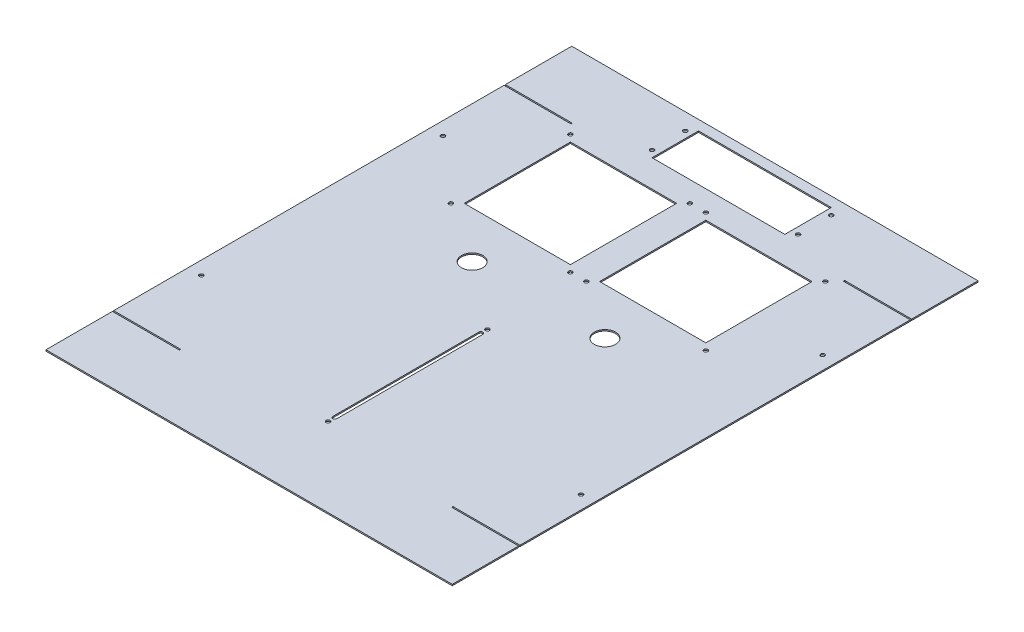
from build123d import *

# Parameters (mm, degrees)
SKETCH1_W               = 306
SKETCH1_H               = 396
BOSS_EXTRUDE1_DEPTH     = 1
SKETCH2_R               = 1.5
CUT_EXTRUDE1_DEPTH      = 251.227896127
SKETCH3_R               = 8
CUT_EXTRUDE2_DEPTH      = 251.227896127
SKETCH4_R               = 1.5
SKETCH4_W               = 80
SKETCH4_H               = 80
CUT_EXTRUDE3_DEPTH      = 251.227896127
SKETCH6_R               = 1.5
CUT_EXTRUDE4_DEPTH      = 251.227896127
MIRROR4_COPY_1_SKETCH_R = 1.5
MIRROR4_COPY_1_DEPTH    = 251.227896127
SKETCH8_R               = 1.5
SKETCH8_W               = 100
SKETCH8_H               = 35
CUT_EXTRUDE6_DEPTH      = 251.227896127


with BuildPart() as part:
    # Sketch1 → Boss-Extrude1 (new body)
    with BuildSketch(Plane(origin=(0, 0, 0), x_dir=(1, 0, 0), z_dir=(0, 1, 0))):
        Rectangle(SKETCH1_W, SKETCH1_H)
    extrude(amount=BOSS_EXTRUDE1_DEPTH)

    # Sketch2 → Cut-Extrude1 (cut, through all)
    with BuildSketch(Plane(origin=(0, 1, 0), x_dir=(1, 0, 0), z_dir=(0, 1, 0))):
        with Locations(Location((0, -18.5, 0), (0, 0, 270))):
            Circle(SKETCH2_R)
        with Locations(Location((0, -138.5, 0), (0, 0, 270))):
            Circle(SKETCH2_R)
        with BuildLine():
            Line((1.5, -23.5), (1.5, -133.5))
            ThreePointArc((1.5, -133.5), (0, -135), (-1.5, -133.5))
            Line((-1.5, -133.5), (-1.5, -23.5))
            ThreePointArc((-1.5, -23.5), (0, -22), (1.5, -23.5))
        make_face()
    extrude(amount=-CUT_EXTRUDE1_DEPTH, mode=Mode.SUBTRACT)

    # Sketch3 → Cut-Extrude2 (cut, through all)
    with BuildSketch(Plane(origin=(0, 1, 0), x_dir=(1, 0, 0), z_dir=(0, 1, 0))):
        with Locations(Location((-50, 20, 0), (0, 0, 270))):
            Circle(SKETCH3_R)
    cut_extrude2 = extrude(amount=-CUT_EXTRUDE2_DEPTH, mode=Mode.SUBTRACT)

    # Mirror1: Cut-Extrude2 across plane
    add(cut_extrude2.mirror(Plane(origin=(0, 0, 0), x_dir=(0, 0, 1), z_dir=(1, 0, 0))), mode=Mode.SUBTRACT)

    # Sketch4 → Cut-Extrude3 (cut, through all)
    with BuildSketch(Plane(origin=(0, 1, 0), x_dir=(1, 0, 0), z_dir=(0, 1, 0))):
        with Locations(Location((-96, 140, 0), (0, 0, 270))):
            Circle(SKETCH4_R)
        with Locations(Location((-6, 140, 0), (0, 0, 270))):
            Circle(SKETCH4_R)
        with Locations(Location((-96, 50, 0), (0, 0, 270))):
            Circle(SKETCH4_R)
        with Locations(Location((-6, 50, 0), (0, 0, 270))):
            Circle(SKETCH4_R)
        with Locations((-51, 95)):
            Rectangle(SKETCH4_W, SKETCH4_H)
    cut_extrude3 = extrude(amount=-CUT_EXTRUDE3_DEPTH, mode=Mode.SUBTRACT)

    # Mirror2: Cut-Extrude3 across plane
    add(cut_extrude3.mirror(Plane(origin=(0, 0, 0), x_dir=(0, 0, 1), z_dir=(1, 0, 0))), mode=Mode.SUBTRACT)

    # Sketch6 → Cut-Extrude4 (cut, through all)
    with BuildSketch(Plane(origin=(0, 1, 0), x_dir=(1, 0, 0), z_dir=(0, 1, 0))):
        with Locations(Location((-143, 91, 0), (0, 0, 270))):
            Circle(SKETCH6_R)
        with BuildLine():
            Line((-153, 148), (-103, 148))
            ThreePointArc((-103, 148), (-102.5, 147.5), (-103, 147))
            Line((-103, 147), (-153, 147))
            ThreePointArc((-153, 147), (-153.5, 147.5), (-153, 148))
        make_face()
    cut_extrude4 = extrude(amount=-CUT_EXTRUDE4_DEPTH, mode=Mode.SUBTRACT)

    # Mirror3: Cut-Extrude4 across plane
    add(cut_extrude4.mirror(Plane.XY), mode=Mode.SUBTRACT)

    # Mirror4: Cut-Extrude4 across plane
    add(cut_extrude4.mirror(Plane(origin=(0, 0, 0), x_dir=(0, 0, 1), z_dir=(1, 0, 0))), mode=Mode.SUBTRACT)

    # Mirror4 copy 1 sketch → Mirror4 copy 1 (cut, through all)
    with BuildSketch(Plane(origin=(0, 1, 0), x_dir=(-1, 0, 0), z_dir=(0, 1, 0))):
        with Locations(Location((-143, 91, 0), (0, 0, 270))):
            Circle(MIRROR4_COPY_1_SKETCH_R)
        with BuildLine():
            Line((-153, 148), (-103, 148))
            ThreePointArc((-103, 148), (-102.5, 147.5), (-103, 147))
            Line((-103, 147), (-153, 147))
            ThreePointArc((-153, 147), (-153.5, 147.5), (-153, 148))
        make_face()
    extrude(amount=-MIRROR4_COPY_1_DEPTH, mode=Mode.SUBTRACT)

    # Sketch8 → Cut-Extrude6 (cut, through all)
    with BuildSketch(Plane(origin=(0, 1, 0), x_dir=(1, 0, 0), z_dir=(0, 1, 0))):
        with Locations(Location((-55, 185.5, 0), (0, 0, 270))):
            Circle(SKETCH8_R)
        with Locations(Location((-55, 160.5, 0), (0, 0, 270))):
            Circle(SKETCH8_R)
        with Locations(Location((55, 160.5, 0), (0, 0, 90))):
            Circle(SKETCH8_R)
        with Locations(Location((55, 185.5, 0), (0, 0, 90))):
            Circle(SKETCH8_R)
        with Locations((0, 173)):
            Rectangle(SKETCH8_W, SKETCH8_H)
    extrude(amount=-CUT_EXTRUDE6_DEPTH, mode=Mode.SUBTRACT)


solid = part.part
